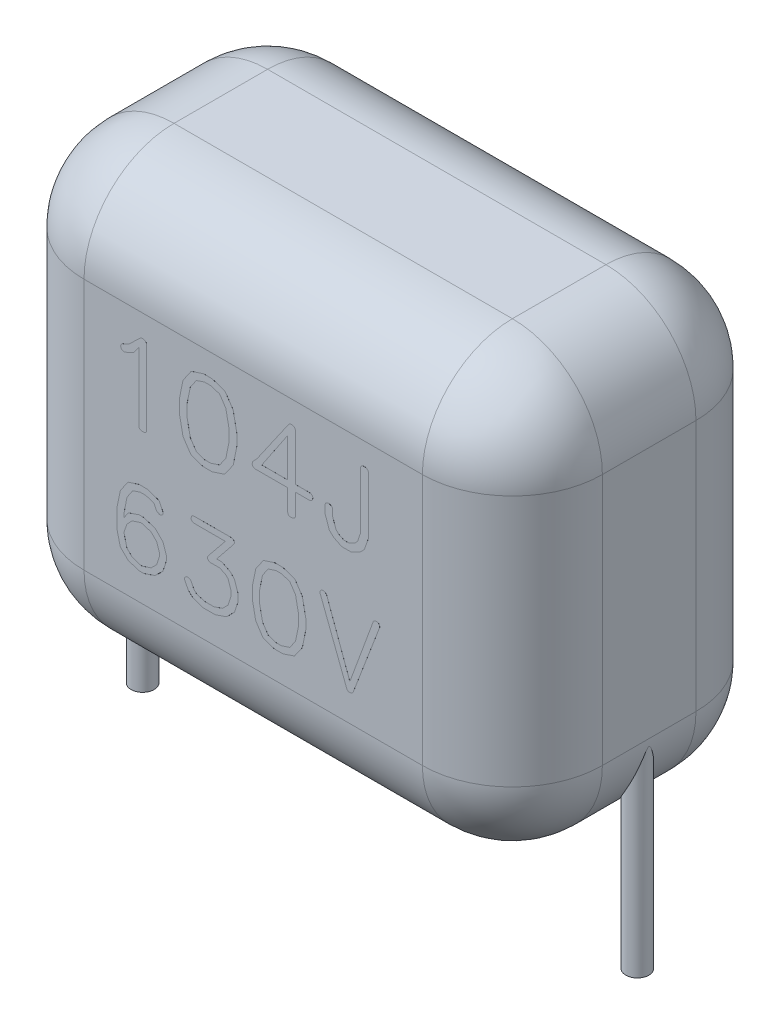
from build123d import *

# Parameters (mm, degrees)
BOSS_EXTRUDE1_DEPTH     = 9
FILLET1_R               = 3.125
BOSS_EXTRUDE2_START     = 4.75
BOSS_EXTRUDE2_DEPTH     = 0.001
SKETCH4_R               = 0.4
BOSS_EXTRUDE3_DEPTH     = 14.5
CUT_EXTRUDE1_DEPTH      = 18.715022062
CUT_EXTRUDE1_DEPTH_BACK = 18.715022062
SKETCH5_W               = 24.818382121
SKETCH5_H               = 5.58906026


with BuildPart() as part:
    # Sketch2 → Boss-Extrude1 (new, symmetric)
    with BuildSketch(Plane(origin=(0, 0, 0), x_dir=(0, 0, -1), z_dir=(1, 0, 0))):
        with BuildLine():
            Line((-1.625, 7.5), (1.625, 7.5))
            ThreePointArc((1.625, 7.5), (3.834708691, 6.584708691), (4.75, 4.375))
            Line((4.75, 4.375), (4.75, -4.375))
            ThreePointArc((4.75, -4.375), (3.834708691, -6.584708691), (1.625, -7.5))
            Line((1.625, -7.5), (-1.625, -7.5))
            ThreePointArc((-1.625, -7.5), (-3.834708691, -6.584708691), (-4.75, -4.375))
            Line((-4.75, -4.375), (-4.75, 4.375))
            ThreePointArc((-4.75, 4.375), (-3.834708691, 6.584708691), (-1.625, 7.5))
        make_face()
    extrude(amount=BOSS_EXTRUDE1_DEPTH, both=True)

    # Fillet1
    fillet1_edges = [part.edges().sort_by_distance(p)[0] for p in [
        (-9, 0, -4.75),
        (-9, -6.584708691, -3.834708691),
        (-9, -7.5, 0),
        (-9, -6.584708691, 3.834708691),
        (9, -6.584708691, -3.834708691),
        (9, 0, -4.75),
        (9, 6.584708691, -3.834708691),
        (9, 7.5, 0),
        (9, 6.584708691, 3.834708691),
        (9, 0, 4.75),
        (9, -6.584708691, 3.834708691),
        (-9, 0, 4.75),
        (9, -7.5, 0),
        (-9, 6.584708691, 3.834708691),
        (-9, 7.5, 0),
        (-9, 6.584708691, -3.834708691),
    ]]
    fillet(fillet1_edges, radius=FILLET1_R)

    # Sketch3 → Boss-Extrude2 (add)
    # profile 1 of 8: a face of its own
    with BuildSketch(Plane.XY.offset(BOSS_EXTRUDE2_START)):
        with BuildLine():
            Line((-3.714583333, 3.5484375), (-3.7, 3.510416667))
            Line((-3.7, 3.510416667), (-3.700520833, 0.894270833))
            add(Edge.make_bspline(
                [(-3.700520833, 0.894270833), (-3.703743039, 0.882961305), (-3.71028971, 0.859983326), (-3.7394661, 0.834040627), (-3.779084511, 0.815603174), (-3.810333734, 0.810921012), (-3.827604167, 0.808333333)],
                knots=[0, 0, 0, 0, 0.841417231, 1.70953787, 2.734135827, 4, 4, 4, 4], degree=3))
            add(Edge.make_bspline(
                [(-3.827604167, 0.808333333), (-3.843329552, 0.808888156), (-3.871736918, 0.809890423), (-3.909751127, 0.820242214), (-3.940057683, 0.837593236), (-3.95064269, 0.856174974), (-3.955729167, 0.865104167)],
                knots=[0, 0, 0, 0, 1.270134227, 2.29445362, 3.180423702, 4, 4, 4, 4], degree=3))
            Line((-3.955729167, 0.865104167), (-3.966666667, 0.8890625))
            Line((-3.966666667, 0.8890625), (-3.966666667, 3.275520833))
            Line((-3.966666667, 3.275520833), (-4.140625, 3.0390625))
            Line((-4.140625, 3.0390625), (-4.438541667, 2.897916667))
            add(Edge.make_bspline(
                [(-4.438541667, 2.897916667), (-4.446160702, 2.896389813), (-4.461832162, 2.893249256), (-4.477755602, 2.891859783), (-4.4859375, 2.891145833)],
                knots=[0, 0, 0, 0, 0.972345423, 2, 2, 2, 2], degree=3))
            add(Edge.make_bspline(
                [(-4.4859375, 2.891145833), (-4.493089577, 2.891584286), (-4.507276875, 2.892454026), (-4.52807943, 2.89832653), (-4.547436541, 2.908606563), (-4.565713256, 2.921783592), (-4.580858243, 2.939042105), (-4.591828943, 2.959161804), (-4.599149402, 2.981798816), (-4.599707979, 2.997855586), (-4.6, 3.00625)],
                knots=[0, 0, 0, 0, 0.951403609, 1.88726267, 2.847872274, 3.854838563, 4.869456482, 5.872176189, 6.887582364, 8, 8, 8, 8], degree=3))
            add(Edge.make_bspline(
                [(-4.6, 3.00625), (-4.599495007, 3.012878141), (-4.598502623, 3.025903405), (-4.595315365, 3.038570467), (-4.59375, 3.044791667)],
                knots=[0, 0, 0, 0, 1.017736074, 2, 2, 2, 2], degree=3))
            add(Edge.make_bspline(
                [(-4.59375, 3.044791667), (-4.586489323, 3.05746692), (-4.572886806, 3.081213376), (-4.54981784, 3.095802395), (-4.5390625, 3.102604167)],
                knots=[0, 0, 0, 0, 1.067549056, 2, 2, 2, 2], degree=3))
            Line((-4.5390625, 3.102604167), (-4.302604167, 3.215625))
            Line((-4.302604167, 3.215625), (-3.921354167, 3.583333333))
            add(Edge.make_bspline(
                [(-3.921354167, 3.583333333), (-3.917010099, 3.58723166), (-3.908072451, 3.595252224), (-3.890991202, 3.602664275), (-3.871810484, 3.607602634), (-3.858196768, 3.608081599), (-3.851041667, 3.608333333)],
                knots=[0, 0, 0, 0, 0.909551796, 1.871345807, 2.881221269, 4, 4, 4, 4], degree=3))
            add(Edge.make_bspline(
                [(-3.851041667, 3.608333333), (-3.838788947, 3.607688959), (-3.814253835, 3.606398649), (-3.778758242, 3.593988529), (-3.744734713, 3.575099757), (-3.724870432, 3.557534174), (-3.714583333, 3.5484375)],
                knots=[0, 0, 0, 0, 0.959833611, 1.921991747, 2.923863585, 4, 4, 4, 4], degree=3))
        make_face()
    # profile 2 of 8: a face of its own
    with BuildSketch(Plane.XY.offset(BOSS_EXTRUDE2_START)):
        with BuildLine():
            add(Edge.make_bspline(
                [(-1.417708333, 3.603645833), (-1.406065966, 3.599682971), (-1.381013009, 3.591155372), (-1.341119849, 3.576825723), (-1.295813393, 3.562036747), (-1.245822281, 3.545347547), (-1.190960651, 3.526759457), (-1.130595665, 3.508051072), (-1.065729695, 3.486309193), (-1.020679959, 3.471986217), (-0.997395833, 3.464583333)],
                knots=[0, 0, 0, 0, 0.666667124, 1.434586464, 2.297647894, 3.24999154, 4.291617403, 5.437502474, 6.675563522, 8, 8, 8, 8], degree=3))
            Line((-0.997395833, 3.464583333), (-0.9546875, 3.421875))
            Line((-0.9546875, 3.421875), (-0.70625, 3.051041667))
            Line((-0.70625, 3.051041667), (-0.692708333, 3.017708333))
            Line((-0.692708333, 3.017708333), (-0.566666667, 2.386458333))
            Line((-0.566666667, 2.386458333), (-0.566666667, 2.009895833))
            Line((-0.566666667, 2.009895833), (-0.692708333, 1.3796875))
            Line((-0.692708333, 1.3796875), (-0.70625, 1.356770833))
            Line((-0.70625, 1.356770833), (-0.98125, 0.963541667))
            Line((-0.98125, 0.963541667), (-1.005208333, 0.946354167))
            add(Edge.make_bspline(
                [(-1.005208333, 0.946354167), (-1.019983742, 0.942251404), (-1.051904318, 0.933387857), (-1.102771617, 0.917710422), (-1.159966008, 0.898821917), (-1.221059488, 0.878280252), (-1.281121172, 0.857768764), (-1.335423548, 0.83890909), (-1.381658472, 0.822916914), (-1.409729464, 0.812867771), (-1.422395833, 0.808333333)],
                knots=[0, 0, 0, 0, 0.8373261, 1.808946996, 2.90620071, 4.126356288, 5.328554329, 6.371898084, 7.265357591, 8, 8, 8, 8], degree=3))
            Line((-1.422395833, 0.808333333), (-1.736458333, 0.808333333))
            add(Edge.make_bspline(
                [(-1.736458333, 0.808333333), (-1.748605109, 0.812171715), (-1.774103448, 0.820229193), (-1.814542102, 0.832572361), (-1.858700189, 0.847339003), (-1.90689861, 0.863504831), (-1.959344129, 0.880478687), (-2.015348753, 0.900129099), (-2.076004656, 0.920085672), (-2.117559146, 0.934650556), (-2.1390625, 0.9421875)],
                knots=[0, 0, 0, 0, 0.720567433, 1.512604951, 2.391447856, 3.354131953, 4.388245663, 5.509345531, 6.711151949, 8, 8, 8, 8], degree=3))
            Line((-2.1390625, 0.9421875), (-2.175, 0.971354167))
            Line((-2.175, 0.971354167), (-2.431770833, 1.3578125))
            Line((-2.431770833, 1.3578125), (-2.441145833, 1.384375))
            Line((-2.441145833, 1.384375), (-2.566666667, 2.013541667))
            Line((-2.566666667, 2.013541667), (-2.566666667, 2.416145833))
            Line((-2.566666667, 2.416145833), (-2.440104167, 3.043229167))
            Line((-2.440104167, 3.043229167), (-2.425, 3.073958333))
            Line((-2.425, 3.073958333), (-2.166145833, 3.448958333))
            Line((-2.166145833, 3.448958333), (-2.134895833, 3.474479167))
            add(Edge.make_bspline(
                [(-2.134895833, 3.474479167), (-2.121325895, 3.478203637), (-2.091444437, 3.486405046), (-2.043483409, 3.50200079), (-1.987143921, 3.518863713), (-1.925953868, 3.538974005), (-1.864715916, 3.559776837), (-1.808356291, 3.577495662), (-1.760525161, 3.594077994), (-1.731091986, 3.603519378), (-1.717708333, 3.6078125)],
                knots=[0, 0, 0, 0, 0.770925878, 1.697604529, 2.762753089, 3.9931098, 5.226441541, 6.306396551, 7.229896193, 8, 8, 8, 8], degree=3))
            Line((-1.717708333, 3.6078125), (-1.417708333, 3.603645833))
        make_face()
        Polygon((-1.165104167, 3.277083333), (-1.46875, 3.375), (-1.686458333, 3.375), (-1.974479167, 3.280208333), (-2.185416667, 2.970833333), (-2.3, 2.401041667), (-2.3, 2.029166667), (-2.182291667, 1.450520833), (-1.969791667, 1.135416667), (-1.688541667, 1.041666667), (-1.472395833, 1.041666667), (-1.1609375, 1.146354167), (-0.947395833, 1.459375), (-0.833333333, 2.028645833), (-0.833333333, 2.371875), (-0.950520833, 2.958854167), align=None, mode=Mode.SUBTRACT)
    # profile 3 of 8: a face of its own
    with BuildSketch(Plane.XY.offset(BOSS_EXTRUDE2_START)):
        with BuildLine():
            Line((1.45, 3.545833333), (1.466666667, 3.506770833))
            Line((1.466666667, 3.506770833), (1.466666667, 1.875))
            Line((1.466666667, 1.875), (1.955208333, 1.874479167))
            add(Edge.make_bspline(
                [(1.955208333, 1.874479167), (1.971099725, 1.871125833), (2.000132446, 1.864999473), (2.037388403, 1.84483438), (2.063359427, 1.815216088), (2.068678267, 1.790886172), (2.071354167, 1.778645833)],
                knots=[0, 0, 0, 0, 1.195577152, 2.184255469, 3.086502086, 4, 4, 4, 4], degree=3))
            add(Edge.make_bspline(
                [(2.071354167, 1.778645833), (2.070851908, 1.766934934), (2.069886846, 1.744433086), (2.059685994, 1.712641386), (2.042086541, 1.685049331), (2.025586007, 1.671141409), (2.0171875, 1.6640625)],
                knots=[0, 0, 0, 0, 1.063672196, 2.043787557, 3.004319249, 4, 4, 4, 4], degree=3))
            Line((2.0171875, 1.6640625), (1.961979167, 1.641666667))
            Line((1.961979167, 1.641666667), (1.466666667, 1.641666667))
            Line((1.466666667, 1.641666667), (1.466666667, 0.901041667))
            add(Edge.make_bspline(
                [(1.466666667, 0.901041667), (1.463206071, 0.892520489), (1.456560219, 0.876156112), (1.440809676, 0.854960972), (1.420630708, 0.838359733), (1.38989632, 0.824941574), (1.355174156, 0.813967347), (1.328004791, 0.809992209), (1.316666667, 0.808333333)],
                knots=[0, 0, 0, 0, 0.881479644, 1.692825178, 2.511522639, 3.362763725, 4.899447501, 6, 6, 6, 6], degree=3))
            add(Edge.make_bspline(
                [(1.316666667, 0.808333333), (1.307624707, 0.808616319), (1.290445966, 0.809153961), (1.266392239, 0.813552448), (1.246151265, 0.821715254), (1.228643579, 0.831759434), (1.216177887, 0.846671941), (1.206092937, 0.863709553), (1.201395293, 0.884495557), (1.200479271, 0.899119463), (1.2, 0.906770833)],
                knots=[0, 0, 0, 0, 1.244483934, 2.364384402, 3.340480475, 4.242091871, 5.105208837, 5.982430491, 6.944388035, 8, 8, 8, 8], degree=3))
            Line((1.2, 0.906770833), (1.2, 1.641666667))
            Line((1.2, 1.641666667), (0.0609375, 1.641666667))
            add(Edge.make_bspline(
                [(0.0609375, 1.641666667), (0.049742633, 1.644110699), (0.028168857, 1.648820625), (0.00029991, 1.667140514), (-0.021035123, 1.693348551), (-0.028754578, 1.714777179), (-0.0328125, 1.726041667)],
                knots=[0, 0, 0, 0, 1.02115313, 1.96787762, 2.931764676, 4, 4, 4, 4], degree=3))
            Line((-0.0328125, 1.726041667), (-0.033333333, 1.753645833))
            add(Edge.make_bspline(
                [(-0.033333333, 1.753645833), (-0.032189184, 1.766968706), (-0.029866112, 1.794019369), (-0.015927696, 1.817334567), (-0.008854167, 1.829166667)],
                knots=[0, 0, 0, 0, 0.985031118, 2, 2, 2, 2], degree=3))
            Line((-0.008854167, 1.829166667), (0.131770833, 1.9796875))
            Line((0.131770833, 1.9796875), (1.240104167, 3.575520833))
            add(Edge.make_bspline(
                [(1.240104167, 3.575520833), (1.24706046, 3.580657761), (1.260221274, 3.590376464), (1.281439386, 3.599999959), (1.301461927, 3.607068937), (1.314876256, 3.607921582), (1.321354167, 3.608333333)],
                knots=[0, 0, 0, 0, 1.161393316, 2.197273816, 3.129445936, 4, 4, 4, 4], degree=3))
            add(Edge.make_bspline(
                [(1.321354167, 3.608333333), (1.326236946, 3.607943107), (1.336630228, 3.607112486), (1.346728987, 3.604506624), (1.352083333, 3.603125)],
                knots=[0, 0, 0, 0, 0.939603003, 2, 2, 2, 2], degree=3))
            add(Edge.make_bspline(
                [(1.352083333, 3.603125), (1.364720146, 3.600423883), (1.387574635, 3.59553874), (1.417071171, 3.583137091), (1.439357821, 3.567238185), (1.446629391, 3.552612715), (1.45, 3.545833333)],
                knots=[0, 0, 0, 0, 1.307248616, 2.364243258, 3.241773542, 4, 4, 4, 4], degree=3))
        make_face()
        Polygon((0.297395833, 1.875), (1.2, 1.875), (1.2, 3.215625), align=None, mode=Mode.SUBTRACT)
    # profile 4 of 8: a face of its own
    with BuildSketch(Plane.XY.offset(BOSS_EXTRUDE2_START)):
        with BuildLine():
            add(Edge.make_bspline(
                [(3.947395833, 3.583854167), (3.953875461, 3.579793272), (3.966630812, 3.571799272), (3.981549221, 3.555170865), (3.993781521, 3.536744074), (3.997910091, 3.522722706), (4, 3.515625)],
                knots=[0, 0, 0, 0, 1.031284857, 2.030116636, 3.002832479, 4, 4, 4, 4], degree=3))
            Line((4, 3.515625), (4, 1.514583333))
            Line((4, 1.514583333), (3.863020833, 1.122395833))
            add(Edge.make_bspline(
                [(3.863020833, 1.122395833), (3.844011732, 1.101813207), (3.808147747, 1.062980492), (3.773196677, 1.023324501), (3.756770833, 1.0046875)],
                knots=[0, 0, 0, 0, 1.060066312, 2, 2, 2, 2], degree=3))
            add(Edge.make_bspline(
                [(3.756770833, 1.0046875), (3.739246953, 0.988531555), (3.706142873, 0.958011621), (3.665488063, 0.938751934), (3.646354167, 0.9296875)],
                knots=[0, 0, 0, 0, 1.05871427, 2, 2, 2, 2], degree=3))
            Line((3.646354167, 0.9296875), (3.401041667, 0.808333333))
            Line((3.401041667, 0.808333333), (3.072395833, 0.808333333))
            Line((3.072395833, 0.808333333), (2.794791667, 0.946875))
            Line((2.794791667, 0.946875), (2.644791667, 1.089583333))
            Line((2.644791667, 1.089583333), (2.629166667, 1.125520833))
            add(Edge.make_bspline(
                [(2.629166667, 1.125520833), (2.622358368, 1.14564724), (2.609163988, 1.184651914), (2.590652743, 1.241386533), (2.57281461, 1.294121531), (2.556165863, 1.343086204), (2.540626658, 1.388255314), (2.526118723, 1.429430844), (2.512353922, 1.466440065), (2.503970019, 1.4899222), (2.5, 1.501041667)],
                knots=[0, 0, 0, 0, 1.283994266, 2.488361529, 3.606466252, 4.648277704, 5.613809846, 6.493184276, 7.286479364, 8, 8, 8, 8], degree=3))
            Line((2.5, 1.501041667), (2.5, 1.796875))
            add(Edge.make_bspline(
                [(2.5, 1.796875), (2.503375067, 1.806767538), (2.510084597, 1.8264336), (2.531514603, 1.850233106), (2.558766627, 1.870032914), (2.58094148, 1.877021008), (2.592708333, 1.880729167)],
                knots=[0, 0, 0, 0, 0.948098409, 1.884790505, 2.877586254, 4, 4, 4, 4], degree=3))
            add(Edge.make_bspline(
                [(2.592708333, 1.880729167), (2.610197153, 1.880172608), (2.643015231, 1.879128217), (2.687844829, 1.865114634), (2.725617615, 1.84326793), (2.742612719, 1.821307991), (2.751041667, 1.810416667)],
                knots=[0, 0, 0, 0, 1.15701742, 2.171163477, 3.092964185, 4, 4, 4, 4], degree=3))
            add(Edge.make_bspline(
                [(2.751041667, 1.810416667), (2.752800915, 1.801589882), (2.756636794, 1.782343888), (2.758305161, 1.750529457), (2.757173523, 1.713615781), (2.75420164, 1.687484062), (2.752604167, 1.6734375)],
                knots=[0, 0, 0, 0, 0.783652803, 1.708682879, 2.768350185, 4, 4, 4, 4], degree=3))
            add(Edge.make_bspline(
                [(2.752604167, 1.6734375), (2.75260297, 1.658499262), (2.752600813, 1.631556383), (2.75490139, 1.595277829), (2.757275704, 1.567302126), (2.76097922, 1.551713626), (2.7625, 1.5453125)],
                knots=[0, 0, 0, 0, 1.391066708, 2.508953354, 3.38772963, 4, 4, 4, 4], degree=3))
            Line((2.7625, 1.5453125), (2.875520833, 1.221875))
            Line((2.875520833, 1.221875), (2.966145833, 1.131770833))
            Line((2.966145833, 1.131770833), (3.150520833, 1.041666667))
            Line((3.150520833, 1.041666667), (3.330729167, 1.041666667))
            Line((3.330729167, 1.041666667), (3.531770833, 1.142708333))
            Line((3.531770833, 1.142708333), (3.622916667, 1.2375))
            Line((3.622916667, 1.2375), (3.733333333, 1.561979167))
            Line((3.733333333, 1.561979167), (3.733333333, 3.526041667))
            add(Edge.make_bspline(
                [(3.733333333, 3.526041667), (3.736208881, 3.536986171), (3.741778409, 3.558184123), (3.763169531, 3.584041516), (3.793194817, 3.601611628), (3.816588105, 3.605644192), (3.829166667, 3.6078125)],
                knots=[0, 0, 0, 0, 0.989737932, 1.916981892, 2.879961938, 4, 4, 4, 4], degree=3))
            add(Edge.make_bspline(
                [(3.829166667, 3.6078125), (3.841348123, 3.607803714), (3.864255388, 3.607787192), (3.896101472, 3.60270525), (3.924066901, 3.596169603), (3.939881394, 3.587821069), (3.947395833, 3.583854167)],
                knots=[0, 0, 0, 0, 1.195561962, 2.248257821, 3.167639525, 4, 4, 4, 4], degree=3))
        make_face()
    # profile 5 of 8: a face of its own
    with BuildSketch(Plane.XY.offset(BOSS_EXTRUDE2_START)):
        with BuildLine():
            add(Edge.make_bspline(
                [(-3.678980655, -0.84125744), (-3.668181208, -0.844809112), (-3.645468198, -0.85227886), (-3.609693025, -0.863927806), (-3.57019498, -0.876328912), (-3.527357789, -0.891138907), (-3.480545033, -0.906430365), (-3.43004539, -0.922909954), (-3.376012467, -0.940723585), (-3.338819149, -0.953275469), (-3.319642857, -0.959747024)],
                knots=[0, 0, 0, 0, 0.721095401, 1.516582161, 2.386469045, 3.346847497, 4.391298568, 5.510135646, 6.716265004, 8, 8, 8, 8], degree=3))
            add(Edge.make_bspline(
                [(-3.319642857, -0.959747024), (-3.310815643, -0.963712026), (-3.294634547, -0.97098024), (-3.273804168, -0.9842858), (-3.257837305, -0.997936702), (-3.250780545, -1.008597648), (-3.247581845, -1.01343006)],
                knots=[0, 0, 0, 0, 1.269410687, 2.326946603, 3.241635493, 4, 4, 4, 4], degree=3))
            add(Edge.make_bspline(
                [(-3.247581845, -1.01343006), (-3.24410066, -1.021840294), (-3.23799642, -1.036587595), (-3.229187127, -1.05562415), (-3.224202882, -1.069369396), (-3.221469493, -1.076626081), (-3.220498512, -1.079203869)],
                knots=[0, 0, 0, 0, 1.535236083, 2.692028147, 3.535369796, 4, 4, 4, 4], degree=3))
            Line((-3.220498512, -1.079203869), (-3.127157738, -1.261532738))
            add(Edge.make_bspline(
                [(-3.127157738, -1.261532738), (-3.127254855, -1.270267873), (-3.127430001, -1.28602134), (-3.130636614, -1.306911579), (-3.133870349, -1.323672009), (-3.139650096, -1.331610578), (-3.142150298, -1.335044643)],
                knots=[0, 0, 0, 0, 1.370318324, 2.471314263, 3.338721358, 4, 4, 4, 4], degree=3))
            add(Edge.make_bspline(
                [(-3.142150298, -1.335044643), (-3.148620021, -1.343298282), (-3.161752866, -1.360052285), (-3.190992436, -1.376157144), (-3.225234832, -1.386750399), (-3.250223963, -1.387724768), (-3.263541667, -1.388244048)],
                knots=[0, 0, 0, 0, 0.903722257, 1.834459236, 2.845897051, 4, 4, 4, 4], degree=3))
            add(Edge.make_bspline(
                [(-3.263541667, -1.388244048), (-3.267178467, -1.383307308), (-3.273442336, -1.37480448), (-3.280222605, -1.363576697), (-3.284999793, -1.357245642), (-3.286764209, -1.35423402), (-3.287239583, -1.353422619)],
                knots=[0, 0, 0, 0, 1.745433014, 3.006258374, 3.732262798, 4, 4, 4, 4], degree=3))
            add(Edge.make_bspline(
                [(-3.287239583, -1.353422619), (-3.290860215, -1.356720688), (-3.298176054, -1.363384758), (-3.315084399, -1.363116469), (-3.332221898, -1.353740773), (-3.342933451, -1.344049414), (-3.349144345, -1.33843006)],
                knots=[0, 0, 0, 0, 0.790298034, 1.596873937, 2.606592163, 4, 4, 4, 4], degree=3))
            Line((-3.349144345, -1.33843006), (-3.444903274, -1.144977679))
            Line((-3.444903274, -1.144977679), (-3.72734375, -1.053571429))
            Line((-3.72734375, -1.053571429), (-3.923214286, -1.053571429))
            Line((-3.923214286, -1.053571429), (-4.184858631, -1.141592262))
            Line((-4.184858631, -1.141592262), (-4.38266369, -1.434188988))
            Line((-4.38266369, -1.434188988), (-4.488095238, -1.979241071))
            Line((-4.488095238, -1.979241071), (-4.488095238, -2.10546875))
            Line((-4.488095238, -2.10546875), (-4.33671875, -1.881063988))
            add(Edge.make_bspline(
                [(-4.33671875, -1.881063988), (-4.325581967, -1.877557983), (-4.301801887, -1.870071702), (-4.264546547, -1.857375834), (-4.222972889, -1.843940506), (-4.177889179, -1.828455855), (-4.128903016, -1.811466418), (-4.076187596, -1.793086781), (-4.019602731, -1.773257924), (-3.980603097, -1.759517281), (-3.960453869, -1.752418155)],
                knots=[0, 0, 0, 0, 0.704624331, 1.504565849, 2.375276859, 3.341379673, 4.381376464, 5.504476647, 6.710683588, 8, 8, 8, 8], degree=3))
            Line((-3.960453869, -1.752418155), (-3.876302083, -1.752418155))
            add(Edge.make_bspline(
                [(-3.876302083, -1.752418155), (-3.865340741, -1.752724452), (-3.845021565, -1.75329224), (-3.817054387, -1.754302017), (-3.794137694, -1.757247179), (-3.780693104, -1.759933818), (-3.774739583, -1.761123512)],
                knots=[0, 0, 0, 0, 1.288773087, 2.389014414, 3.286624979, 4, 4, 4, 4], degree=3))
            Line((-3.774739583, -1.761123512), (-3.427008929, -1.87671131))
            Line((-3.427008929, -1.87671131), (-3.38203125, -1.902827381))
            Line((-3.38203125, -1.902827381), (-3.139732143, -2.149479167))
            Line((-3.139732143, -2.149479167), (-3.129575893, -2.168824405))
            add(Edge.make_bspline(
                [(-3.129575893, -2.168824405), (-3.109659316, -2.230002478), (-3.070992805, -2.348775029), (-3.029672307, -2.466650198), (-3.009635417, -2.523809524)],
                knots=[0, 0, 0, 0, 1.030171906, 2, 2, 2, 2], degree=3))
            Line((-3.009635417, -2.523809524), (-3.009635417, -2.611830357))
            add(Edge.make_bspline(
                [(-3.009635417, -2.611830357), (-3.010142416, -2.619102297), (-3.011369138, -2.63669729), (-3.017841396, -2.66737269), (-3.02825118, -2.706725317), (-3.041768937, -2.755531357), (-3.059739467, -2.81302478), (-3.081564518, -2.879647731), (-3.107952649, -2.954893846), (-3.126524372, -3.008242755), (-3.136346726, -3.036458333)],
                knots=[0, 0, 0, 0, 0.393708682, 0.952607053, 1.690276144, 2.595265412, 3.689613708, 4.946287359, 6.384929175, 8, 8, 8, 8], degree=3))
            add(Edge.make_bspline(
                [(-3.136346726, -3.036458333), (-3.154919754, -3.056410295), (-3.1939998, -3.098391796), (-3.258602504, -3.162320776), (-3.330636179, -3.231877336), (-3.382538472, -3.278904547), (-3.409598214, -3.303422619)],
                knots=[0, 0, 0, 0, 0.855870955, 1.800862928, 2.853459483, 4, 4, 4, 4], degree=3))
            add(Edge.make_bspline(
                [(-3.409598214, -3.303422619), (-3.444564315, -3.315882314), (-3.512955573, -3.340252608), (-3.613463277, -3.375185914), (-3.709779962, -3.40706855), (-3.772626618, -3.427124481), (-3.80327381, -3.436904762)],
                knots=[0, 0, 0, 0, 1.071487312, 2.095754568, 3.07139409, 4, 4, 4, 4], degree=3))
            Line((-3.80327381, -3.436904762), (-3.966741071, -3.436904762))
            add(Edge.make_bspline(
                [(-3.966741071, -3.436904762), (-3.979002154, -3.43290182), (-4.00565665, -3.424199782), (-4.04872438, -3.409442058), (-4.09865533, -3.393188655), (-4.152934721, -3.374987191), (-4.207238686, -3.356859495), (-4.257397946, -3.340323653), (-4.301279107, -3.325911179), (-4.328500368, -3.316813165), (-4.341071429, -3.312611607)],
                knots=[0, 0, 0, 0, 0.784803938, 1.706093542, 2.770072957, 3.979840327, 5.189607698, 6.253587113, 7.193488419, 8, 8, 8, 8], degree=3))
            add(Edge.make_bspline(
                [(-4.341071429, -3.312611607), (-4.349135889, -3.3048776), (-4.366087389, -3.288620715), (-4.392830301, -3.262808518), (-4.422159535, -3.234589074), (-4.453745852, -3.203299042), (-4.487951795, -3.169636111), (-4.524844122, -3.133177444), (-4.564334985, -3.094321019), (-4.59129295, -3.067272756), (-4.605133929, -3.053385417)],
                knots=[0, 0, 0, 0, 0.724688505, 1.523295456, 2.410607614, 3.364364385, 4.406837613, 5.523241516, 6.728362512, 8, 8, 8, 8], degree=3))
            Line((-4.605133929, -3.053385417), (-4.620126488, -3.023883929))
            Line((-4.620126488, -3.023883929), (-4.735714286, -2.544605655))
            Line((-4.735714286, -2.544605655), (-4.735714286, -1.942485119))
            Line((-4.735714286, -1.942485119), (-4.61625744, -1.361160714))
            Line((-4.61625744, -1.361160714), (-4.602232143, -1.332626488))
            Line((-4.602232143, -1.332626488), (-4.364285714, -0.983928571))
            Line((-4.364285714, -0.983928571), (-4.33671875, -0.960714286))
            add(Edge.make_bspline(
                [(-4.33671875, -0.960714286), (-4.324125607, -0.957231408), (-4.296589338, -0.94961572), (-4.252092377, -0.935695727), (-4.200281895, -0.9201175), (-4.144032035, -0.901182979), (-4.087883014, -0.882148061), (-4.036147095, -0.865343123), (-3.992115462, -0.850253164), (-3.964976697, -0.841391825), (-3.952715774, -0.837388393)],
                knots=[0, 0, 0, 0, 0.777350156, 1.699760211, 2.773784865, 3.996165612, 5.230679096, 6.301400701, 7.232596048, 8, 8, 8, 8], degree=3))
            Line((-3.952715774, -0.837388393), (-3.678980655, -0.84125744))
        make_face()
        Polygon((-3.544047619, -2.062909226), (-3.8390625, -1.962797619), (-3.918377976, -1.962797619), (-4.202752976, -2.057105655), (-4.386532738, -2.244754464), (-4.488578869, -2.54750744), (-4.385565476, -2.96343006), (-4.203720238, -3.143340774), (-3.924181548, -3.23813244), (-3.841480655, -3.240550595), (-3.544047619, -3.140438988), (-3.350595238, -2.946502976), (-3.250967262, -2.646168155), (-3.250967262, -2.560081845), (-3.350111607, -2.2578125), align=None, mode=Mode.SUBTRACT)
    # profile 6 of 8: a face of its own
    with BuildSketch(Plane.XY.offset(BOSS_EXTRUDE2_START)):
        with BuildLine():
            add(Edge.make_bspline(
                [(-0.653385417, -0.938950893), (-0.653917494, -0.944341483), (-0.655106862, -0.956391215), (-0.664128463, -0.975112674), (-0.67701519, -0.996644449), (-0.688347505, -1.011290013), (-0.694494048, -1.019233631)],
                knots=[0, 0, 0, 0, 0.705310812, 1.576600164, 2.68557046, 4, 4, 4, 4], degree=3))
            add(Edge.make_bspline(
                [(-0.694494048, -1.019233631), (-0.700292277, -1.026658912), (-0.710061059, -1.03916893), (-0.72186985, -1.054122882), (-0.727182706, -1.062588549), (-0.729637022, -1.06501812), (-0.729799107, -1.065178571)],
                knots=[0, 0, 0, 0, 1.94989614, 3.285159586, 3.952791308, 4, 4, 4, 4], degree=3))
            Line((-0.729799107, -1.065178571), (-1.26953125, -1.73452381))
            Line((-1.26953125, -1.73452381), (-1.09155506, -1.73452381))
            add(Edge.make_bspline(
                [(-1.09155506, -1.73452381), (-1.07431852, -1.743094312), (-1.035713108, -1.762290031), (-0.971348702, -1.793474975), (-0.895095443, -1.831363267), (-0.840079846, -1.858359512), (-0.810565476, -1.872842262)],
                knots=[0, 0, 0, 0, 0.737558743, 1.651941734, 2.740330688, 4, 4, 4, 4], degree=3))
            Line((-0.810565476, -1.872842262), (-0.679501488, -2.001004464))
            add(Edge.make_bspline(
                [(-0.679501488, -2.001004464), (-0.67618112, -2.004962952), (-0.668485184, -2.014137917), (-0.657965724, -2.031821129), (-0.647738643, -2.055289084), (-0.640758421, -2.072722625), (-0.636941964, -2.082254464)],
                knots=[0, 0, 0, 0, 0.671532767, 1.556475723, 2.663995935, 4, 4, 4, 4], degree=3))
            add(Edge.make_bspline(
                [(-0.636941964, -2.082254464), (-0.633685153, -2.091432213), (-0.626728613, -2.111035863), (-0.616420397, -2.142319445), (-0.60405089, -2.176883864), (-0.590678869, -2.214770585), (-0.575926135, -2.256116952), (-0.560822194, -2.30095817), (-0.543514435, -2.348970878), (-0.532108204, -2.382250427), (-0.526190476, -2.399516369)],
                knots=[0, 0, 0, 0, 0.695503182, 1.485593126, 2.352256562, 3.317274428, 4.355098821, 5.487480367, 6.696466121, 8, 8, 8, 8], degree=3))
            Line((-0.526190476, -2.399516369), (-0.526190476, -2.658258929))
            add(Edge.make_bspline(
                [(-0.526190476, -2.658258929), (-0.538521878, -2.693214241), (-0.562132063, -2.760141052), (-0.594684927, -2.856392214), (-0.624681671, -2.943337989), (-0.642205931, -2.998700395), (-0.650483631, -3.02485119)],
                knots=[0, 0, 0, 0, 1.149019596, 2.199957941, 3.149738334, 4, 4, 4, 4], degree=3))
            add(Edge.make_bspline(
                [(-0.650483631, -3.02485119), (-0.654828868, -3.029533205), (-0.665379571, -3.040901637), (-0.684305956, -3.060826956), (-0.709492088, -3.086267284), (-0.74040615, -3.117740573), (-0.777351064, -3.155114165), (-0.820092284, -3.198458354), (-0.869131919, -3.247436281), (-0.903891529, -3.281835305), (-0.922284226, -3.300037202)],
                knots=[0, 0, 0, 0, 0.396334984, 0.962343867, 1.705032162, 2.617463817, 3.699640798, 4.965709851, 6.394435872, 8, 8, 8, 8], degree=3))
            add(Edge.make_bspline(
                [(-0.922284226, -3.300037202), (-0.936602288, -3.305598416), (-0.967176062, -3.317473438), (-1.016454242, -3.33462066), (-1.071717795, -3.353115758), (-1.130713033, -3.371502836), (-1.188516144, -3.389273329), (-1.239828104, -3.406893514), (-1.28296536, -3.42214506), (-1.308729355, -3.432327068), (-1.3203125, -3.436904762)],
                knots=[0, 0, 0, 0, 0.875550517, 1.869588483, 2.973905178, 4.197540941, 5.392119851, 6.420894454, 7.290055419, 8, 8, 8, 8], degree=3))
            Line((-1.3203125, -3.436904762), (-1.730431548, -3.436904762))
            add(Edge.make_bspline(
                [(-1.730431548, -3.436904762), (-1.741249585, -3.433571665), (-1.764248121, -3.42648569), (-1.800185184, -3.414181861), (-1.840099497, -3.401251761), (-1.883718409, -3.386535605), (-1.931454258, -3.370939444), (-1.982503701, -3.352737925), (-2.037539503, -3.33389814), (-2.075424083, -3.320840491), (-2.095089286, -3.3140625)],
                knots=[0, 0, 0, 0, 0.705964982, 1.500841575, 2.368852637, 3.322704548, 4.371941651, 5.500778361, 6.702699059, 8, 8, 8, 8], degree=3))
            add(Edge.make_bspline(
                [(-2.095089286, -3.3140625), (-2.097534802, -3.31216001), (-2.103765471, -3.307312858), (-2.114162184, -3.297330121), (-2.128734258, -3.284526858), (-2.146698355, -3.267988896), (-2.1679757, -3.247502764), (-2.192979805, -3.223499552), (-2.22150498, -3.195922996), (-2.241632829, -3.176392353), (-2.252269345, -3.166071429)],
                knots=[0, 0, 0, 0, 0.344185002, 0.876912226, 1.600080393, 2.500426414, 3.590308767, 4.882858918, 6.352753844, 8, 8, 8, 8], degree=3))
            Line((-2.252269345, -3.166071429), (-2.383333333, -2.914583333))
            Line((-2.383333333, -2.914583333), (-2.383333333, -2.886049107))
            add(Edge.make_bspline(
                [(-2.383333333, -2.886049107), (-2.382951715, -2.879079362), (-2.38221202, -2.865569824), (-2.376802025, -2.846471708), (-2.367984149, -2.829384093), (-2.359537624, -2.820110503), (-2.355282738, -2.815438988)],
                knots=[0, 0, 0, 0, 1.071409628, 2.076725879, 3.031162259, 4, 4, 4, 4], degree=3))
            add(Edge.make_bspline(
                [(-2.355282738, -2.815438988), (-2.348196905, -2.810463405), (-2.333688349, -2.800275681), (-2.308370386, -2.790518979), (-2.280448981, -2.784455695), (-2.261010427, -2.78384142), (-2.250818452, -2.783519345)],
                knots=[0, 0, 0, 0, 0.930989546, 1.906241964, 2.902205946, 4, 4, 4, 4], degree=3))
            add(Edge.make_bspline(
                [(-2.250818452, -2.783519345), (-2.239237366, -2.787371805), (-2.217510193, -2.794599369), (-2.188902561, -2.80982931), (-2.166910417, -2.829061194), (-2.157610431, -2.844667796), (-2.153125, -2.85219494)],
                knots=[0, 0, 0, 0, 1.190779191, 2.234010111, 3.148254052, 4, 4, 4, 4], degree=3))
            Line((-2.153125, -2.85219494), (-2.049144345, -3.054352679))
            Line((-2.049144345, -3.054352679), (-1.96547619, -3.13125))
            Line((-1.96547619, -3.13125), (-1.688355655, -3.220238095))
            Line((-1.688355655, -3.220238095), (-1.368191964, -3.220238095))
            Line((-1.368191964, -3.220238095), (-1.07172619, -3.12109375))
            Line((-1.07172619, -3.12109375), (-0.877306548, -2.929575893))
            Line((-0.877306548, -2.929575893), (-0.773809524, -2.624404762))
            Line((-0.773809524, -2.624404762), (-0.773809524, -2.43046875))
            Line((-0.773809524, -2.43046875), (-0.874888393, -2.129650298))
            Line((-0.874888393, -2.129650298), (-0.963392857, -2.045982143))
            Line((-0.963392857, -2.045982143), (-1.159747024, -1.951190476))
            Line((-1.159747024, -1.951190476), (-1.500706845, -1.951190476))
            add(Edge.make_bspline(
                [(-1.500706845, -1.951190476), (-1.511998759, -1.948046973), (-1.533344234, -1.942104706), (-1.559564873, -1.921907582), (-1.577660976, -1.894306831), (-1.581744746, -1.872629662), (-1.583891369, -1.861235119)],
                knots=[0, 0, 0, 0, 1.060559127, 2.004809592, 2.951233776, 4, 4, 4, 4], degree=3))
            add(Edge.make_bspline(
                [(-1.583891369, -1.861235119), (-1.583744328, -1.853607823), (-1.583458711, -1.838792282), (-1.577475923, -1.817983231), (-1.570253804, -1.798309513), (-1.56194409, -1.787395135), (-1.557775298, -1.781919643)],
                knots=[0, 0, 0, 0, 1.069911866, 2.078236428, 3.035895545, 4, 4, 4, 4], degree=3))
            Line((-1.557775298, -1.781919643), (-0.967745536, -1.053571429))
            Line((-0.967745536, -1.053571429), (-2.068005952, -1.053571429))
            add(Edge.make_bspline(
                [(-2.068005952, -1.053571429), (-2.078480474, -1.051415091), (-2.098712008, -1.047250126), (-2.123713049, -1.028490326), (-2.144488612, -1.004127966), (-2.151398007, -0.983338469), (-2.155059524, -0.972321429)],
                knots=[0, 0, 0, 0, 1.003705415, 1.938656653, 2.907626134, 4, 4, 4, 4], degree=3))
            add(Edge.make_bspline(
                [(-2.155059524, -0.972321429), (-2.154539578, -0.958685416), (-2.153568827, -0.933226704), (-2.143181333, -0.898567036), (-2.126805383, -0.869362853), (-2.109810248, -0.856720259), (-2.101376488, -0.850446429)],
                knots=[0, 0, 0, 0, 1.173058835, 2.190124616, 3.101857482, 4, 4, 4, 4], degree=3))
            Line((-2.101376488, -0.850446429), (-2.068973214, -0.84077381))
            Line((-2.068973214, -0.84077381), (-0.80234375, -0.836904762))
            add(Edge.make_bspline(
                [(-0.80234375, -0.836904762), (-0.79071881, -0.837113782), (-0.768803632, -0.837507824), (-0.738177066, -0.842190717), (-0.712147885, -0.85026655), (-0.690784075, -0.861527272), (-0.673373812, -0.875710267), (-0.66166646, -0.894246075), (-0.654716062, -0.915740371), (-0.65384141, -0.930996973), (-0.653385417, -0.938950893)],
                knots=[0, 0, 0, 0, 1.361140597, 2.566003605, 3.617322652, 4.53840774, 5.382486279, 6.215502827, 7.06966529, 8, 8, 8, 8], degree=3))
        make_face()
    # profile 7 of 8: a face of its own
    with BuildSketch(Plane.XY.offset(BOSS_EXTRUDE2_START)):
        with BuildLine():
            add(Edge.make_bspline(
                [(1.0359375, -0.84125744), (1.04674827, -0.844937242), (1.07001173, -0.852855726), (1.107055378, -0.866161828), (1.149125659, -0.87989445), (1.195545977, -0.895391564), (1.246488919, -0.912651932), (1.302542121, -0.930024004), (1.362774807, -0.950212892), (1.404606705, -0.963512798), (1.426227679, -0.970386905)],
                knots=[0, 0, 0, 0, 0.666667124, 1.434586464, 2.297647894, 3.24999154, 4.291617403, 5.437502474, 6.675563522, 8, 8, 8, 8], degree=3))
            Line((1.426227679, -0.970386905), (1.465885417, -1.010044643))
            Line((1.465885417, -1.010044643), (1.696577381, -1.354389881))
            Line((1.696577381, -1.354389881), (1.709151786, -1.385342262))
            Line((1.709151786, -1.385342262), (1.826190476, -1.971502976))
            Line((1.826190476, -1.971502976), (1.826190476, -2.321168155))
            Line((1.826190476, -2.321168155), (1.709151786, -2.906361607))
            Line((1.709151786, -2.906361607), (1.696577381, -2.927641369))
            Line((1.696577381, -2.927641369), (1.441220238, -3.292782738))
            Line((1.441220238, -3.292782738), (1.418973214, -3.30874256))
            add(Edge.make_bspline(
                [(1.418973214, -3.30874256), (1.405253192, -3.312552267), (1.375612657, -3.320782704), (1.328378737, -3.335340322), (1.275269659, -3.352879648), (1.21854, -3.371954052), (1.162768435, -3.391000433), (1.1123448, -3.408512988), (1.069412371, -3.423362865), (1.04334645, -3.432694213), (1.031584821, -3.436904762)],
                knots=[0, 0, 0, 0, 0.8373261, 1.808946996, 2.90620071, 4.126356288, 5.328554329, 6.371898084, 7.265357591, 8, 8, 8, 8], degree=3))
            Line((1.031584821, -3.436904762), (0.739955357, -3.436904762))
            add(Edge.make_bspline(
                [(0.739955357, -3.436904762), (0.728676209, -3.43334055), (0.704999179, -3.425858607), (0.667449001, -3.414397093), (0.626445063, -3.400685212), (0.581689386, -3.385674086), (0.532989976, -3.369912648), (0.480985682, -3.351665837), (0.424662343, -3.333134733), (0.386076031, -3.319610198), (0.366108631, -3.312611607)],
                knots=[0, 0, 0, 0, 0.720567433, 1.512604951, 2.391447856, 3.354131953, 4.388245663, 5.509345531, 6.711151949, 8, 8, 8, 8], degree=3))
            Line((0.366108631, -3.312611607), (0.332738095, -3.285528274))
            Line((0.332738095, -3.285528274), (0.094308036, -2.926674107))
            Line((0.094308036, -2.926674107), (0.085602679, -2.902008929))
            Line((0.085602679, -2.902008929), (-0.030952381, -2.317782738))
            Line((-0.030952381, -2.317782738), (-0.030952381, -1.943936012))
            Line((-0.030952381, -1.943936012), (0.08656994, -1.361644345))
            Line((0.08656994, -1.361644345), (0.100595238, -1.333110119))
            Line((0.100595238, -1.333110119), (0.340959821, -0.984895833))
            Line((0.340959821, -0.984895833), (0.369977679, -0.961197917))
            add(Edge.make_bspline(
                [(0.369977679, -0.961197917), (0.382578336, -0.95773948), (0.410325404, -0.950123886), (0.454860644, -0.935642124), (0.507175883, -0.919983696), (0.563995218, -0.901309853), (0.62085903, -0.881992937), (0.673192968, -0.865539743), (0.717607588, -0.850141863), (0.744938394, -0.841374863), (0.757366071, -0.837388393)],
                knots=[0, 0, 0, 0, 0.770925878, 1.697604529, 2.762753089, 3.9931098, 5.226441541, 6.306396551, 7.229896193, 8, 8, 8, 8], degree=3))
            Line((0.757366071, -0.837388393), (1.0359375, -0.84125744))
        make_face()
        Polygon((1.270498512, -1.144494048), (0.988541667, -1.053571429), (0.786383929, -1.053571429), (0.518936012, -1.141592262), (0.323065476, -1.428869048), (0.216666667, -1.95796131), (0.216666667, -2.30327381), (0.325967262, -2.840587798), (0.52328869, -3.133184524), (0.784449405, -3.220238095), (0.98515625, -3.220238095), (1.27436756, -3.123028274), (1.47265625, -2.832366071), (1.578571429, -2.30375744), (1.578571429, -1.985044643), (1.469754464, -1.43999256), align=None, mode=Mode.SUBTRACT)
    # profile 8 of 8: a face of its own
    with BuildSketch(Plane.XY.offset(BOSS_EXTRUDE2_START)):
        with BuildLine():
            Line((2.547767857, -0.899293155), (3.35688244, -3.109002976))
            Line((3.35688244, -3.109002976), (4.17421875, -0.887202381))
            add(Edge.make_bspline(
                [(4.17421875, -0.887202381), (4.179625526, -0.880841695), (4.190580056, -0.867954471), (4.211736763, -0.852689817), (4.237112751, -0.842715078), (4.25523868, -0.83889161), (4.264657738, -0.836904762)],
                knots=[0, 0, 0, 0, 0.941490308, 1.907529456, 2.912656994, 4, 4, 4, 4], degree=3))
            add(Edge.make_bspline(
                [(4.264657738, -0.836904762), (4.278794561, -0.839371706), (4.304813454, -0.84391213), (4.339703159, -0.856473338), (4.367739445, -0.873579329), (4.380150152, -0.889697483), (4.386049107, -0.897358631)],
                knots=[0, 0, 0, 0, 1.230515753, 2.264770466, 3.175224993, 4, 4, 4, 4], degree=3))
            add(Edge.make_bspline(
                [(4.386049107, -0.897358631), (4.388669033, -0.906489262), (4.394154428, -0.92560626), (4.394866252, -0.945490708), (4.395238095, -0.955877976)],
                knots=[0, 0, 0, 0, 0.955236947, 2, 2, 2, 2], degree=3))
            Line((4.395238095, -0.955877976), (3.469084821, -3.375967262))
            add(Edge.make_bspline(
                [(3.469084821, -3.375967262), (3.462196766, -3.385373777), (3.448434065, -3.404168491), (3.417447369, -3.42319082), (3.380650132, -3.435147961), (3.353767803, -3.436294846), (3.339471726, -3.436904762)],
                knots=[0, 0, 0, 0, 0.926907138, 1.852009549, 2.857694344, 4, 4, 4, 4], degree=3))
            add(Edge.make_bspline(
                [(3.339471726, -3.436904762), (3.329007457, -3.436311134), (3.309035774, -3.435178159), (3.281805831, -3.42222198), (3.260462603, -3.400755105), (3.25201863, -3.382286143), (3.247581845, -3.372581845)],
                knots=[0, 0, 0, 0, 1.039201397, 1.983377929, 2.940389844, 4, 4, 4, 4], degree=3))
            Line((3.247581845, -3.372581845), (2.321428571, -0.963616071))
            add(Edge.make_bspline(
                [(2.321428571, -0.963616071), (2.321637114, -0.953912836), (2.322025433, -0.935844858), (2.326561292, -0.911070645), (2.332717379, -0.889755623), (2.340477614, -0.878511515), (2.344159226, -0.873177083)],
                knots=[0, 0, 0, 0, 1.225410797, 2.281784662, 3.184844019, 4, 4, 4, 4], degree=3))
            add(Edge.make_bspline(
                [(2.344159226, -0.873177083), (2.351416646, -0.8676055), (2.365038746, -0.857147697), (2.386433343, -0.846239521), (2.406200203, -0.838560092), (2.419224165, -0.837437757), (2.425409226, -0.836904762)],
                knots=[0, 0, 0, 0, 1.211172824, 2.273358799, 3.180020493, 4, 4, 4, 4], degree=3))
            add(Edge.make_bspline(
                [(2.425409226, -0.836904762), (2.435197064, -0.837913044), (2.457447776, -0.840205173), (2.489948806, -0.854743702), (2.523378492, -0.87195274), (2.539962667, -0.890543557), (2.547767857, -0.899293155)],
                knots=[0, 0, 0, 0, 0.833475419, 1.894741526, 3.009179322, 4, 4, 4, 4], degree=3))
        make_face()
    extrude(amount=BOSS_EXTRUDE2_DEPTH)

    # Sketch4 → Boss-Extrude3 (add)
    with BuildSketch(Plane(origin=(0, 0, 0), x_dir=(1, 0, 0), z_dir=(0, 1, 0))):
        with Locations(Location((-8.59, 0, 0), (0, 0, 270))):
            Circle(SKETCH4_R)
        with Locations(Location((8.59, 0, 0), (0, 0, 270))):
            Circle(SKETCH4_R)
    extrude(amount=-BOSS_EXTRUDE3_DEPTH)

    # Sketch5 → Cut-Extrude1 (cut, two sides: drawn at the far end of the back side and taken through both)
    with BuildSketch(Plane.XY.offset(-CUT_EXTRUDE1_DEPTH_BACK)):
        with Locations((1.132584899, -14.29453013)):
            Rectangle(SKETCH5_W, SKETCH5_H)
    extrude(amount=CUT_EXTRUDE1_DEPTH + CUT_EXTRUDE1_DEPTH_BACK, mode=Mode.SUBTRACT)


solid = part.part
